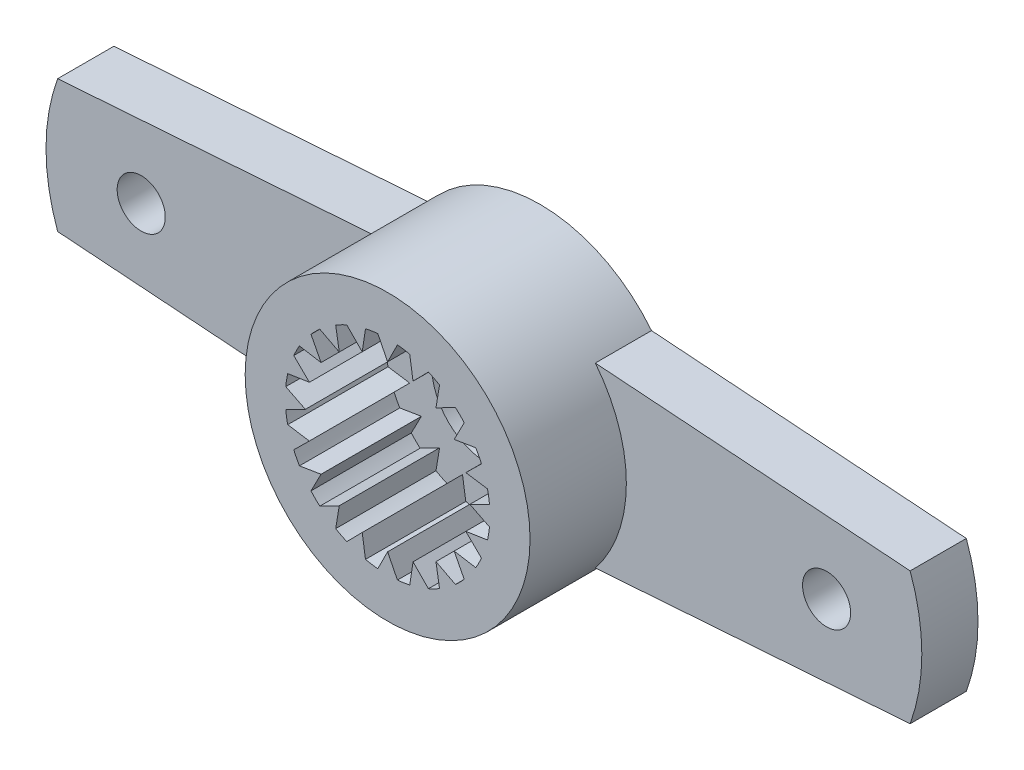
from build123d import *

# Parameters (mm, degrees)
SKETCH2_R           = 3.55
BOSS_EXTRUDE1_DEPTH = 3.8
BOSS_EXTRUDE2_DEPTH = 1.4
SKETCH5_R           = 2.549999919
CUT_EXTRUDE1_DEPTH  = 2.5
BOSS_EXTRUDE3_DEPTH = 2.5
SKETCH6_R           = 1.4
CUT_EXTRUDE2_DEPTH  = 12.745554295
SKETCH7_R           = 0.6
CUT_EXTRUDE3_DEPTH  = 12.724676785


with BuildPart() as part:
    # Sketch2 → Boss-Extrude1 (new body)
    with BuildSketch(Plane.XY):
        Circle(SKETCH2_R)
    extrude(amount=-BOSS_EXTRUDE1_DEPTH)

    # Sketch4 → Boss-Extrude2 (add)
    with BuildSketch(Plane.XY.offset(-2.4)):
        with BuildLine():
            Line((2.776387215, 2.212277889), (10.622617722, 1.649999976))
            ThreePointArc((10.622617722, 1.649999976), (10.913548722, 0), (10.622617722, -1.649999976))
            Line((10.622617722, -1.649999976), (2.776387215, -2.212277889))
            ThreePointArc((2.776387215, -2.212277889), (3.549999952, 0), (2.776387215, 2.212277889))
        make_face()
    boss_extrude2 = extrude(amount=-BOSS_EXTRUDE2_DEPTH)

    # Sketch5 → Cut-Extrude1 (cut)
    with BuildSketch(Plane.XY):
        Circle(SKETCH5_R)
    extrude(amount=-CUT_EXTRUDE1_DEPTH, mode=Mode.SUBTRACT)

    # Sketch3 → Boss-Extrude3 (add)
    with BuildSketch(Plane.XY):
        with BuildLine():
            Line((-0.244697916, 2.538232164), (0, 2.049999952))
            Line((0, 2.049999952), (0.244697916, 2.538232164))
            ThreePointArc((0.244697916, 2.538232164), (0, 2.549999919), (-0.244697916, 2.538232164))
        make_face()
        with BuildLine():
            Line((0.551635326, 2.489618054), (0.633484824, 1.949665813))
            Line((0.633484824, 1.949665813), (1.017078422, 2.338386424))
            ThreePointArc((1.017078422, 2.338386424), (0.787993311, 2.42519404), (0.551635326, 2.489618054))
        make_face()
        with BuildLine():
            Line((1.29397066, 2.197302783), (1.204959739, 1.6584848))
            Line((1.204959739, 1.6584848), (1.689900206, 1.90964313))
            ThreePointArc((1.689900206, 1.90964313), (1.498852346, 2.06299327), (1.29397066, 2.197302783))
        make_face()
        with BuildLine():
            Line((1.90964313, 1.689900206), (1.6584848, 1.204959739))
            Line((1.6584848, 1.204959739), (2.197302783, 1.29397066))
            ThreePointArc((2.197302783, 1.29397066), (2.06299327, 1.498852346), (1.90964313, 1.689900206))
        make_face()
        with BuildLine():
            Line((2.338386424, 1.017078422), (1.949665813, 0.633484824))
            Line((1.949665813, 0.633484824), (2.489618054, 0.551635326))
            ThreePointArc((2.489618054, 0.551635326), (2.42519404, 0.787993311), (2.338386424, 1.017078422))
        make_face()
        with BuildLine():
            Line((2.538232164, 0.244697916), (2.049999952, 0))
            Line((2.049999952, 0), (2.538232164, -0.244697916))
            ThreePointArc((2.538232164, -0.244697916), (2.549999919, 0), (2.538232164, 0.244697916))
        make_face()
        with BuildLine():
            Line((2.489618054, -0.551635326), (1.949665813, -0.633484824))
            Line((1.949665813, -0.633484824), (2.338386424, -1.017078422))
            ThreePointArc((2.338386424, -1.017078422), (2.42519404, -0.787993311), (2.489618054, -0.551635326))
        make_face()
        with BuildLine():
            Line((2.197302783, -1.29397066), (1.6584848, -1.204959739))
            Line((1.6584848, -1.204959739), (1.90964313, -1.689900206))
            ThreePointArc((1.90964313, -1.689900206), (2.06299327, -1.498852346), (2.197302783, -1.29397066))
        make_face()
        with BuildLine():
            Line((1.689900206, -1.90964313), (1.204959739, -1.6584848))
            Line((1.204959739, -1.6584848), (1.29397066, -2.197302783))
            ThreePointArc((1.29397066, -2.197302783), (1.498852346, -2.06299327), (1.689900206, -1.90964313))
        make_face()
        with BuildLine():
            Line((1.017078422, -2.338386424), (0.633484824, -1.949665813))
            Line((0.633484824, -1.949665813), (0.551635326, -2.489618054))
            ThreePointArc((0.551635326, -2.489618054), (0.787993311, -2.42519404), (1.017078422, -2.338386424))
        make_face()
        with BuildLine():
            Line((0.244697916, -2.538232164), (0, -2.049999952))
            Line((0, -2.049999952), (-0.244697916, -2.538232164))
            ThreePointArc((-0.244697916, -2.538232164), (0, -2.549999919), (0.244697916, -2.538232164))
        make_face()
        with BuildLine():
            Line((-0.551635326, -2.489618054), (-0.633484824, -1.949665813))
            Line((-0.633484824, -1.949665813), (-1.017078422, -2.338386424))
            ThreePointArc((-1.017078422, -2.338386424), (-0.787993311, -2.42519404), (-0.551635326, -2.489618054))
        make_face()
        with BuildLine():
            Line((-1.29397066, -2.197302783), (-1.204959739, -1.6584848))
            Line((-1.204959739, -1.6584848), (-1.689900206, -1.90964313))
            ThreePointArc((-1.689900206, -1.90964313), (-1.498852346, -2.06299327), (-1.29397066, -2.197302783))
        make_face()
        with BuildLine():
            Line((-1.90964313, -1.689900206), (-1.6584848, -1.204959739))
            Line((-1.6584848, -1.204959739), (-2.197302783, -1.29397066))
            ThreePointArc((-2.197302783, -1.29397066), (-2.06299327, -1.498852346), (-1.90964313, -1.689900206))
        make_face()
        with BuildLine():
            Line((-2.338386424, -1.017078422), (-1.949665813, -0.633484824))
            Line((-1.949665813, -0.633484824), (-2.489618054, -0.551635326))
            ThreePointArc((-2.489618054, -0.551635326), (-2.42519404, -0.787993311), (-2.338386424, -1.017078422))
        make_face()
        with BuildLine():
            Line((-2.538232164, -0.244697916), (-2.049999952, 0))
            Line((-2.049999952, 0), (-2.538232164, 0.244697916))
            ThreePointArc((-2.538232164, 0.244697916), (-2.549999919, 0), (-2.538232164, -0.244697916))
        make_face()
        with BuildLine():
            Line((-2.489618054, 0.551635326), (-1.949665813, 0.633484824))
            Line((-1.949665813, 0.633484824), (-2.338386424, 1.017078422))
            ThreePointArc((-2.338386424, 1.017078422), (-2.42519404, 0.787993311), (-2.489618054, 0.551635326))
        make_face()
        with BuildLine():
            Line((-2.197302783, 1.29397066), (-1.6584848, 1.204959739))
            Line((-1.6584848, 1.204959739), (-1.90964313, 1.689900206))
            ThreePointArc((-1.90964313, 1.689900206), (-2.06299327, 1.498852346), (-2.197302783, 1.29397066))
        make_face()
        with BuildLine():
            Line((-1.689900206, 1.90964313), (-1.204959739, 1.6584848))
            Line((-1.204959739, 1.6584848), (-1.29397066, 2.197302783))
            ThreePointArc((-1.29397066, 2.197302783), (-1.498852346, 2.06299327), (-1.689900206, 1.90964313))
        make_face()
        with BuildLine():
            Line((-1.017078422, 2.338386424), (-0.633484824, 1.949665813))
            Line((-0.633484824, 1.949665813), (-0.551635326, 2.489618054))
            ThreePointArc((-0.551635326, 2.489618054), (-0.787993311, 2.42519404), (-1.017078422, 2.338386424))
        make_face()
    extrude(amount=-BOSS_EXTRUDE3_DEPTH)

    # Sketch6 → Cut-Extrude2 (cut, through all)
    with BuildSketch(Plane.XY.offset(-2.5)):
        Circle(SKETCH6_R)
    extrude(amount=-CUT_EXTRUDE2_DEPTH, mode=Mode.SUBTRACT)

    # Sketch7 → Cut-Extrude3 (cut, through all)
    with BuildSketch(Plane.XY.offset(-2.4)):
        with Locations((8.5405208, 0)):
            Circle(SKETCH7_R)
    cut_extrude3 = extrude(amount=-CUT_EXTRUDE3_DEPTH, mode=Mode.SUBTRACT)

    # Mirror1: Boss-Extrude2 across plane
    add(boss_extrude2.mirror(Plane(origin=(0, 0, 0), x_dir=(0, 0, 1), z_dir=(1, 0, 0))))

    # Mirror2: Cut-Extrude3 across plane
    add(cut_extrude3.mirror(Plane(origin=(0, 0, 0), x_dir=(0, 0, 1), z_dir=(1, 0, 0))), mode=Mode.SUBTRACT)


solid = part.part
